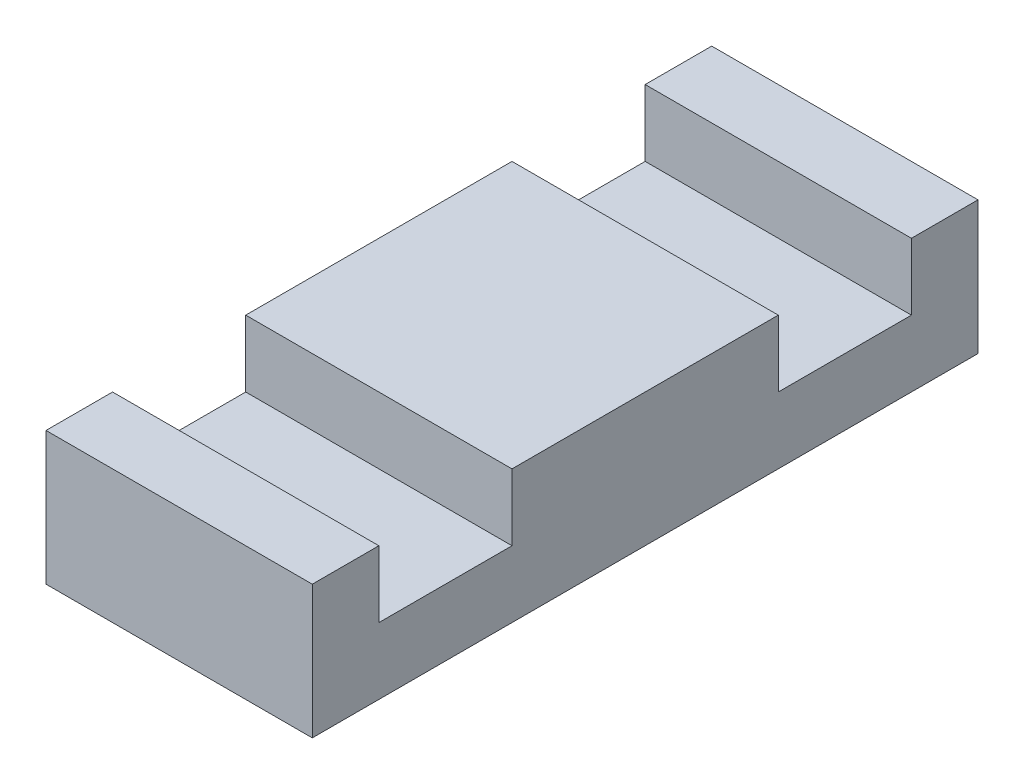
from build123d import *

# Parameters (mm, degrees)
SKETCH1_W           = 25.4
SKETCH1_H           = 63.5
BOSS_EXTRUDE1_DEPTH = 12.7
SKETCH2_W           = 25.4
SKETCH2_H           = 12.7
CUT_EXTRUDE1_DEPTH  = 6.35


with BuildPart() as part:
    # Sketch1 → Boss-Extrude1 (new body)
    with BuildSketch(Plane(origin=(0, 0, 0), x_dir=(1, 0, 0), z_dir=(0, 1, 0))):
        Rectangle(SKETCH1_W, SKETCH1_H)
    extrude(amount=BOSS_EXTRUDE1_DEPTH)

    # Sketch2 → Cut-Extrude1 (cut)
    with BuildSketch(Plane(origin=(0, 12.7, 0), x_dir=(1, 0, 0), z_dir=(0, 1, 0))):
        with Locations((0, 19.05)):
            Rectangle(SKETCH2_W, SKETCH2_H)
        with Locations((0, -19.05)):
            Rectangle(SKETCH2_W, SKETCH2_H)
    extrude(amount=-CUT_EXTRUDE1_DEPTH, mode=Mode.SUBTRACT)


solid = part.part
